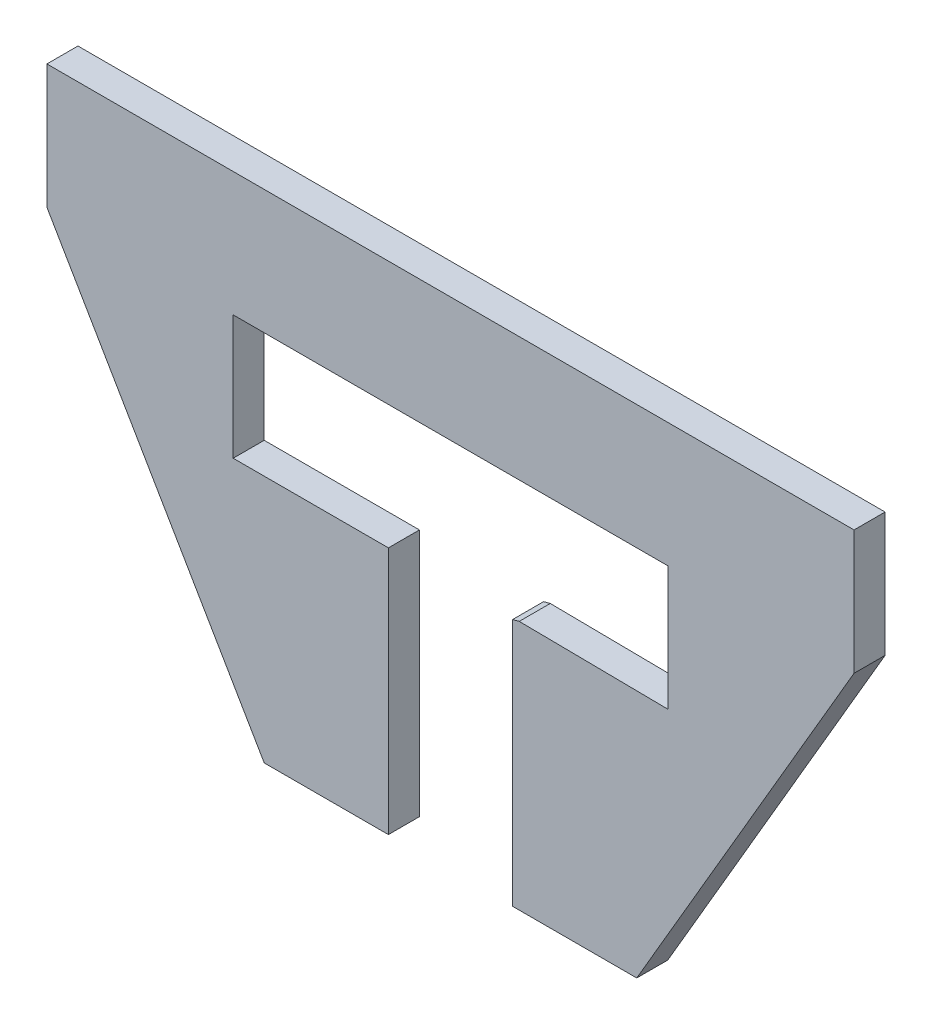
from build123d import *

# Parameters (mm, degrees)
BOSS_EXTRUDE1_DEPTH = 6.35
CUT_EXTRUDE1_DEPTH  = 6.35


with BuildPart() as part:
    # Sketch1 → Boss-Extrude1 (new body)
    with BuildSketch(Plane.XY):
        Polygon((0, 101.6), (0, 76.2), (44.45, 0), (120.65, 0), (165.1, 76.2), (165.1, 101.6), align=None)
    extrude(amount=BOSS_EXTRUDE1_DEPTH)

    # Sketch2 → Cut-Extrude1 (cut)
    with BuildSketch(Plane.XY.offset(6.35)):
        Polygon((38.1, 76.2), (127, 76.2), (127, 50.8), (96.613225755, 51.156306651), (95.25, 50.8), (95.25, 0), (69.85, 0), (69.85, 50.8), (38.1, 50.8), align=None)
    extrude(amount=-CUT_EXTRUDE1_DEPTH, mode=Mode.SUBTRACT)


solid = part.part
